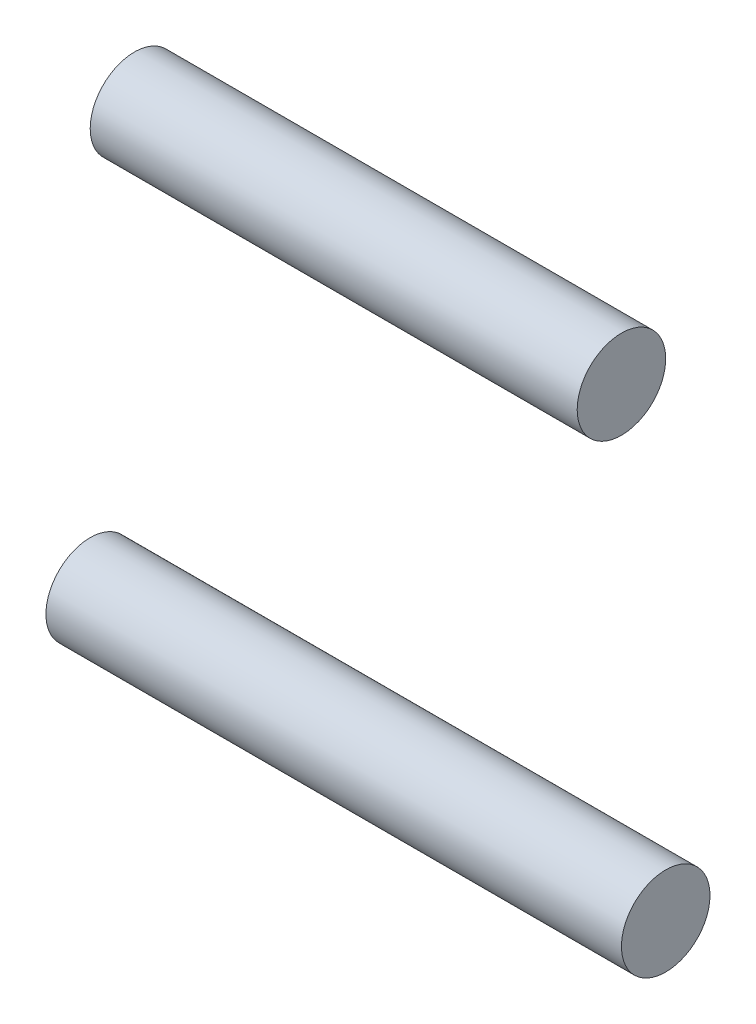
from build123d import *

# Parameters (mm, degrees)
WYCI_GNI_CIE_PO_CIE_CE1_PROFILE_R = 10
WYCI_GNI_CIE_PO_CIE_CE2_PROFILE_R = 10


with BuildPart() as part:
    # Wyciągnięcie po ścieżce1: sweep along a path in Szkic1
    with BuildLine(Plane.XY) as wyci_gni_cie_po_cie_ce1_path:
        Line((165, 100), (55, 100))
    # Wyciągnięcie po ścieżce1 profile (on start of the path) → Wyciągnięcie po ścieżce1 (sweep)
    with BuildSketch(Plane(origin=(165, 100, 0), x_dir=(0, 0, -1), z_dir=(-1, 0, 0))):
        Circle(WYCI_GNI_CIE_PO_CIE_CE1_PROFILE_R)
    sweep(path=wyci_gni_cie_po_cie_ce1_path.line)


with BuildPart() as body_2:
    # Wyciągnięcie po ścieżce2: sweep along a path in Szkic6
    with BuildLine(Plane.XY) as wyci_gni_cie_po_cie_ce2_path:
        Line((45, 0), (175, 0))
    # Wyciągnięcie po ścieżce2 profile (on start of the path) → Wyciągnięcie po ścieżce2 (sweep)
    with BuildSketch(Plane(origin=(45, 0, 0), x_dir=(0, 0, 1), z_dir=(1, 0, 0))):
        Circle(WYCI_GNI_CIE_PO_CIE_CE2_PROFILE_R)
    sweep(path=wyci_gni_cie_po_cie_ce2_path.line)


solid = Compound([part.part, body_2.part])
